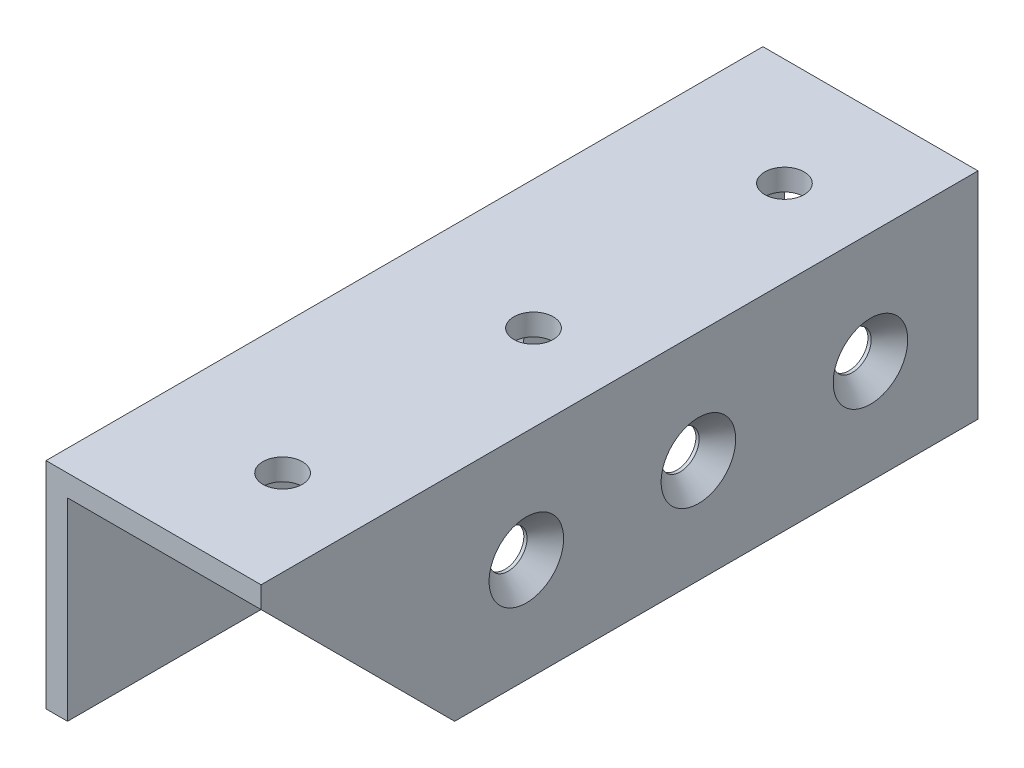
from build123d import *

# Parameters (mm, degrees)
DODANIE_WYCI_GNI_CIE1_DEPTH                         = 100
M5_CLEARANCE_HOLE1_D                                = 5.5
CSK_FOR_M5_COUNTERSUNK_FLAT_HEAD_SCREW1_D           = 5.3
CSK_FOR_M5_COUNTERSUNK_FLAT_HEAD_SCREW1_CSINK_D     = 10.4
CSK_FOR_M5_COUNTERSUNK_FLAT_HEAD_SCREW1_CSINK_ANGLE = 90
CHAMFER1_SIZE                                       = 27


with BuildPart() as part:
    # Szkic1 → Dodanie-wyciągnięcie1 (new body)
    with BuildSketch(Plane.XY):
        Polygon((0, 0), (0, 30), (30, 30), (30, 0), (27, 0), (27, 27), (3, 27), (3, 0), align=None)
    extrude(amount=DODANIE_WYCI_GNI_CIE1_DEPTH)

    # M5 Clearance Hole1 (through all)
    with Locations(Plane(origin=(0, 30, 0), x_dir=(1, 0, 0), z_dir=(0, 1, 0))):
        with Locations((18, -50), (18, -15), (18, -85)):
            Hole(M5_CLEARANCE_HOLE1_D / 2)

    # CSK for M5 Countersunk Flat Head Screw1 (through all)
    with Locations(Plane(origin=(30, 0, 0), x_dir=(0, 0, -1), z_dir=(1, 0, 0))):
        with Locations((-15, 14.5), (-63, 14.5), (-39, 14.5)):
            CounterSinkHole(CSK_FOR_M5_COUNTERSUNK_FLAT_HEAD_SCREW1_D / 2, CSK_FOR_M5_COUNTERSUNK_FLAT_HEAD_SCREW1_CSINK_D / 2, counter_sink_angle=CSK_FOR_M5_COUNTERSUNK_FLAT_HEAD_SCREW1_CSINK_ANGLE)

    # Chamfer1
    chamfer1_edges = [part.edges().sort_by_distance(p)[0] for p in [
        (28.5, 0, 100),
    ]]
    chamfer(chamfer1_edges, length=CHAMFER1_SIZE)


solid = part.part
